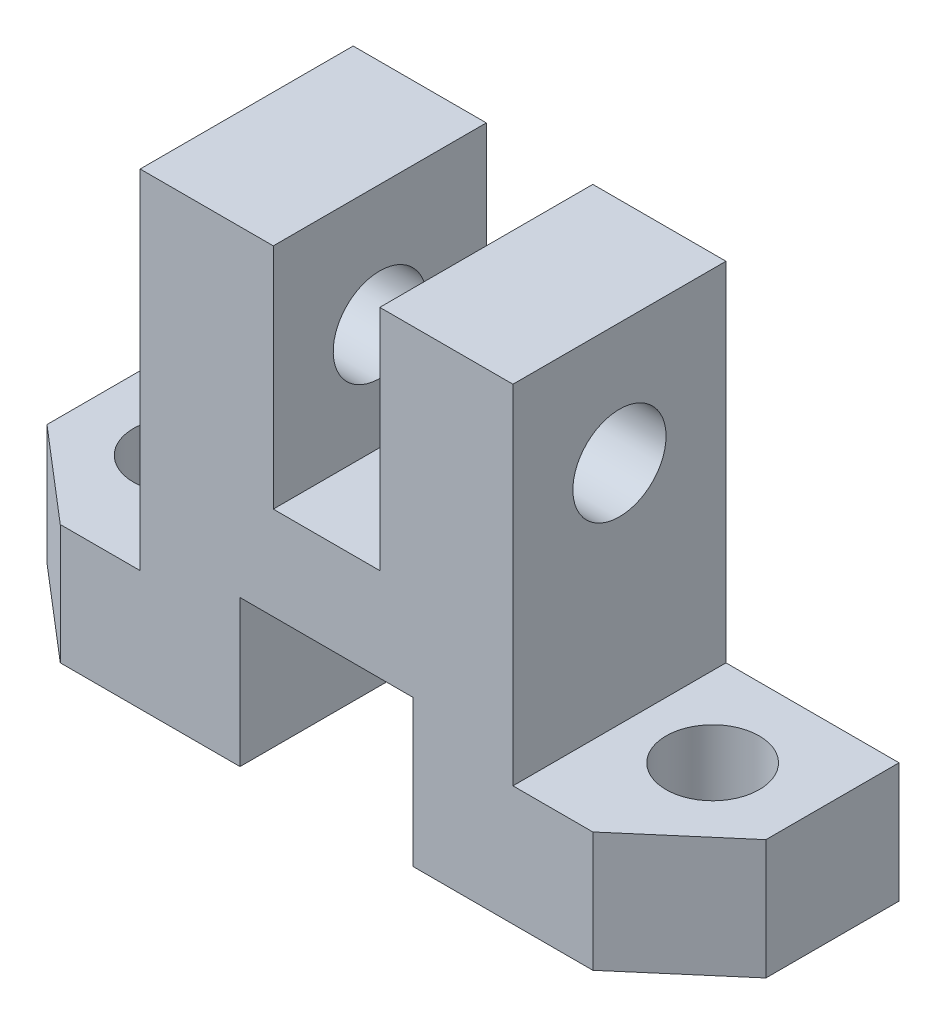
from build123d import *

# Parameters (mm, degrees)
CROQUIS2_R                = 3.5
SALIENTE_EXTRUIR1_DEPTH   = 9
SALIENTE_EXTRUIR1_2_DEPTH = 9
SALIENTE_EXTRUIR2_DEPTH   = 16
CROQUIS4_R                = 3.5
CORTAR_EXTRUIR1_DEPTH     = 28


with BuildPart() as part:
    # Croquis2 → Saliente-Extruir1 (new body)
    with BuildSketch(Plane(origin=(0, 0, 0), x_dir=(1, 0, 0), z_dir=(0, 1, 0))):
        Polygon((-27, 7), (-27, -3), (-20, -9), (-6.5, -9), (-6.5, 7), align=None)
        with Locations(Location((-20, 0, 0), (0, 0, 270))):
            Circle(CROQUIS2_R, mode=Mode.SUBTRACT)
    extrude(amount=SALIENTE_EXTRUIR1_DEPTH)



with BuildPart() as body_2:
    # Croquis2 → Saliente-Extruir1 2 (new body)
    with BuildSketch(Plane(origin=(0, 0, 0), x_dir=(1, 0, 0), z_dir=(0, 1, 0))):
        Polygon((6.5, 7), (27, 7), (27, -3), (20, -9), (6.5, -9), align=None)
        with Locations(Location((20, 0, 0), (0, 0, 90))):
            Circle(CROQUIS2_R, mode=Mode.SUBTRACT)
    extrude(amount=SALIENTE_EXTRUIR1_2_DEPTH)


with BuildPart() as part_1:
    add(part.part)

    add(body_2.part)  # Saliente-Extruir2 merges body 2
    # Croquis3 → Saliente-Extruir2 (add)
    with BuildSketch(Plane.XY.offset(9)):
        Polygon((6.5, 9), (6.5, 11), (-6.5, 11), (-6.5, 9), (-14, 9), (-14, 35.124101005), (-4, 35.124101005), (-4, 18), (4, 18), (4, 35.124101005), (14, 35.124101005), (14, 9), align=None)
    extrude(amount=-SALIENTE_EXTRUIR2_DEPTH)

    # Croquis4 → Cortar-Extruir1 (cut)
    with BuildSketch(Plane(origin=(14, 0, 0), x_dir=(0, 0, -1), z_dir=(1, 0, 0))):
        with Locations((-1, 26)):
            Circle(CROQUIS4_R)
    extrude(amount=-CORTAR_EXTRUIR1_DEPTH, mode=Mode.SUBTRACT)


solid = part_1.part
